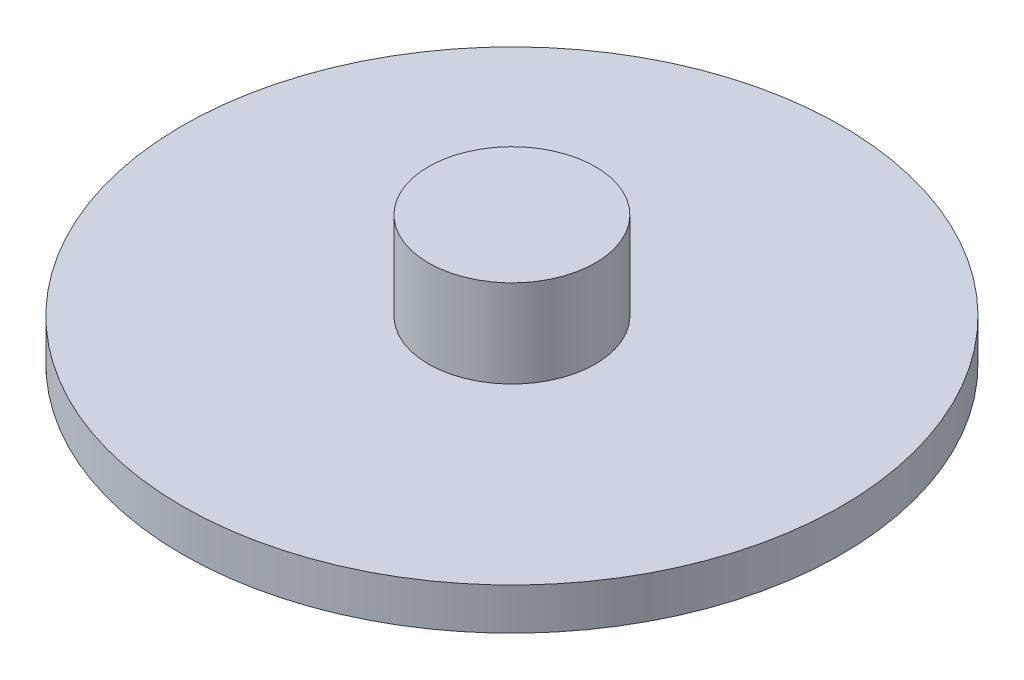
from build123d import *

# Parameters (mm, degrees)
SKETCH1_R           = 7.9
BOSS_EXTRUDE1_DEPTH = 1
SKETCH2_R           = 2
BOSS_EXTRUDE2_DEPTH = 2.1


with BuildPart() as part:
    # Sketch1 → Boss-Extrude1 (new body)
    with BuildSketch(Plane(origin=(0, 0, 0), x_dir=(1, 0, 0), z_dir=(0, 1, 0))):
        with Locations(Location((0, 0, 0), (0, 0, 270))):
            Circle(SKETCH1_R)
    extrude(amount=BOSS_EXTRUDE1_DEPTH)

    # Sketch2 → Boss-Extrude2 (add)
    with BuildSketch(Plane(origin=(0, 1, 0), x_dir=(1, 0, 0), z_dir=(0, 1, 0))):
        with Locations(Location((0, 0, 0), (0, 0, 270))):
            Circle(SKETCH2_R)
    extrude(amount=BOSS_EXTRUDE2_DEPTH)


solid = part.part
